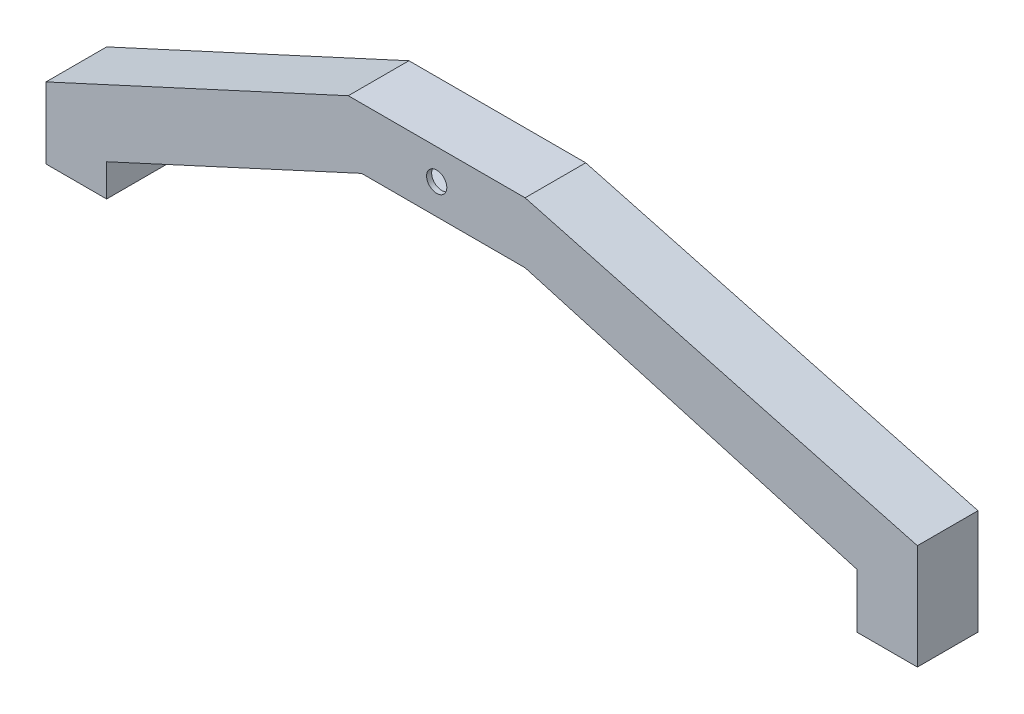
from build123d import *

# Parameters (mm, degrees)
BOSS_EXTRUDE1_DEPTH = 12
SHELL1_T            = -1
SKETCH2_W           = 10
SKETCH2_H           = 10
CUT_EXTRUDE1_DEPTH  = 12
SKETCH3_R           = 2
CUT_EXTRUDE2_DEPTH  = 12
CUT_EXTRUDE3_REACH  = 106.556
SKETCH5_W           = 0.21800788
SKETCH5_H           = 12


with BuildPart() as part:
    # Sketch1 → Boss-Extrude1 (new body)
    with BuildSketch(Plane.XY):
        Polygon((82.939086493, -35.63), (82.939086493, -24.776717085), (17.5, -6), (-14.870410096, -6), (-65.342905627, -29.23610302), (-65.342905627, -35.63), (-77.342905627, -35.63), (-77.342905627, -21.549973615), (-17.5, 6), (17.5, 6), (95.157094373, -14.812940234), (95.157094373, -35.63), align=None)
    extrude(amount=BOSS_EXTRUDE1_DEPTH)

    # Shell1
    shell1_openings = [part.faces().sort_by_distance(p)[0] for p in [
        (-71.342905627, -35.63, 6),
    ]]
    offset(amount=SHELL1_T, openings=shell1_openings, kind=Kind.INTERSECTION)

    # Sketch2 → Cut-Extrude1 (cut)
    with BuildSketch(Plane.XZ.offset(35.63)):
        with Locations((89.157094373, 6.101364163)):
            Rectangle(SKETCH2_W, SKETCH2_H)
    extrude(amount=-CUT_EXTRUDE1_DEPTH, mode=Mode.SUBTRACT)

    # Sketch3 → Cut-Extrude2 (cut)
    with BuildSketch(Plane.XY.offset(12)):
        Circle(SKETCH3_R)
    extrude(amount=-CUT_EXTRUDE2_DEPTH, mode=Mode.SUBTRACT)

    # Cut-Extrude3: up to this plane
    cut_extrude3_end = Plane(origin=(-0.259447613, -0.904205708, 12), z_dir=(0.2758051234336251, 0.9612135735037052, 0))
    # Sketch5 → Cut-Extrude3 (cut, up to the surface)
    with BuildSketch(Plane.XZ.offset(35.63), mode=Mode.PRIVATE) as cut_extrude3_sk1:
        with Locations((83.048090433, 6)):
            Rectangle(SKETCH5_W, SKETCH5_H)
    cut_extrude3_tool1 = split(extrude(cut_extrude3_sk1.sketch, amount=-CUT_EXTRUDE3_REACH, mode=Mode.PRIVATE), bisect_by=cut_extrude3_end, keep=Keep.BOTH, mode=Mode.PRIVATE)
    add(cut_extrude3_tool1.solids().sort_by_distance((83.04809, -35.63, 6))[0], mode=Mode.SUBTRACT)


solid = part.part
